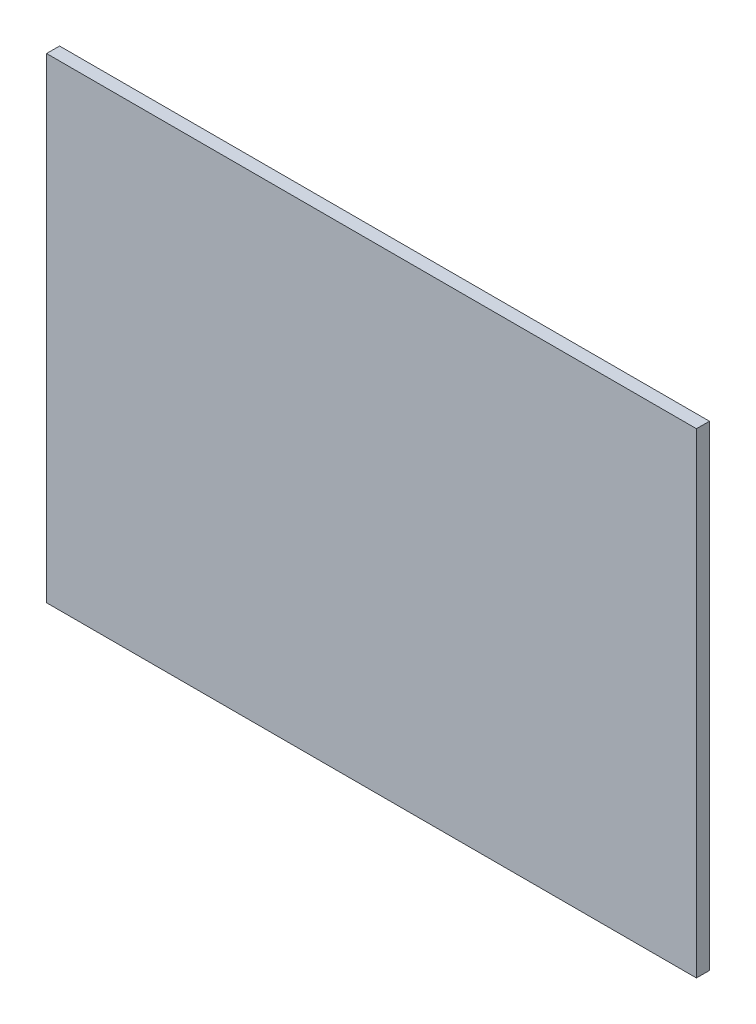
from build123d import *

# Parameters (mm, degrees)
SKETCH1_W           = 5000
SKETCH1_H           = 3659.999999986
BOSS_EXTRUDE1_DEPTH = 100


with BuildPart() as part:
    # Sketch1 → Boss-Extrude1 (new body)
    with BuildSketch(Plane.XY):
        Rectangle(SKETCH1_W, SKETCH1_H)
    extrude(amount=BOSS_EXTRUDE1_DEPTH)


solid = part.part
